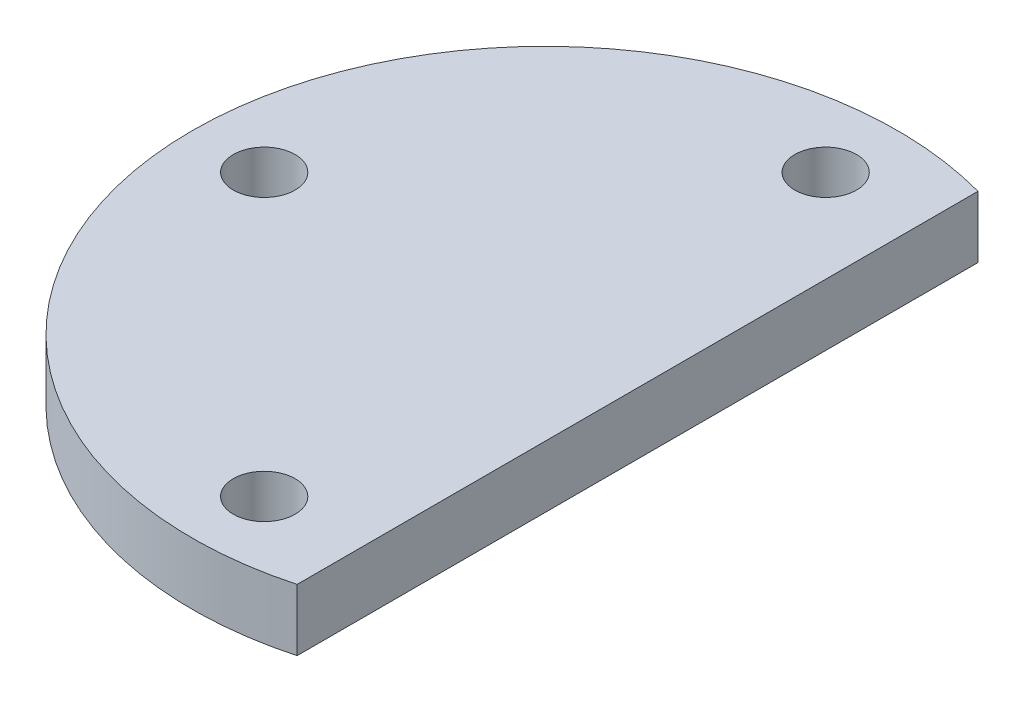
from build123d import *

# Parameters (mm, degrees)
CROQUIS2_R                 = 1.5
CORTAR_EXTRUIR1_DEPTH      = 10
CROQUIS3_R                 = 1.5
SALIENTE_EXTRUIR1_DEPTH    = 3
CORTAR_EXTRUIR2_DEPTH      = 21
CORTAR_EXTRUIR2_DEPTH_BACK = 19
CROQUIS4_W                 = 22.988642253
CROQUIS4_H                 = 9.839710734
CROQUIS5_W                 = 15
CROQUIS5_H                 = 36.969240602
CORTAR_EXTRUIR3_DEPTH      = 19
CROQUIS6_W                 = 9.874263727
CROQUIS6_H                 = 12.802666517
SALIENTE_EXTRUIR2_DEPTH    = 3


with BuildPart() as part:
    # Croquis1 → Revolución1 (revolve)
    with BuildSketch(Plane.XY, mode=Mode.PRIVATE) as revoluci_n1_sk:
        Polygon((-4, 0), (-4, 7), (-5, 7), (-10.142857143, 3), (-17.142857143, 3), (-17.142857143, 0), (-14, 0), align=None)
    revolve(revoluci_n1_sk.sketch.rotate(Axis((0, 0, 0), (0, 1, 0)), 270), axis=Axis((0, 0, 0), (0, 1, 0)))

    # Croquis2 → Cortar-Extruir1 (cut)
    with BuildSketch(Plane(origin=(0, 3, 0), x_dir=(1, 0, 0), z_dir=(0, 1, 0))):
        with Locations(Location((0, 13.64, 0), (0, 0, 270))):
            Circle(CROQUIS2_R)
        with Locations(Location((13.64, 0, 0), (0, 0, 270))):
            Circle(CROQUIS2_R)
        with Locations(Location((0, -13.64, 0), (0, 0, 270))):
            Circle(CROQUIS2_R)
        with Locations(Location((-13.64, 0, 0), (0, 0, 270))):
            Circle(CROQUIS2_R)
    extrude(amount=-CORTAR_EXTRUIR1_DEPTH, mode=Mode.SUBTRACT)

    # Croquis3 → Saliente-Extruir1 (add)
    with BuildSketch(Plane(origin=(0, 3, 0), x_dir=(1, 0, 0), z_dir=(0, 1, 0))):
        with Locations((13.64, 0)):
            Circle(CROQUIS3_R)
    extrude(amount=-SALIENTE_EXTRUIR1_DEPTH)

    # Croquis4 → Cortar-Extruir2 (cut, two sides: drawn at the far end of the back side and taken through both)
    with BuildSketch(Plane.XY.offset(-CORTAR_EXTRUIR2_DEPTH_BACK)):
        with Locations((-1.351463984, 7.919855367)):
            Rectangle(CROQUIS4_W, CROQUIS4_H)
    extrude(amount=CORTAR_EXTRUIR2_DEPTH + CORTAR_EXTRUIR2_DEPTH_BACK, mode=Mode.SUBTRACT)

    # Croquis5 → Cortar-Extruir3 (cut)
    with BuildSketch(Plane(origin=(0, 3, 0), x_dir=(1, 0, 0), z_dir=(0, 1, 0))):
        with Locations((12, -0.045754011)):
            Rectangle(CROQUIS5_W, CROQUIS5_H)
    extrude(amount=-CORTAR_EXTRUIR3_DEPTH, mode=Mode.SUBTRACT)

    # Croquis6 → Saliente-Extruir2 (add)
    with BuildSketch(Plane(origin=(0, 3, 0), x_dir=(1, 0, 0), z_dir=(0, 1, 0))):
        with Locations((-0.437131864, -0.705770923)):
            Rectangle(CROQUIS6_W, CROQUIS6_H)
    extrude(amount=-SALIENTE_EXTRUIR2_DEPTH)


solid = part.part
